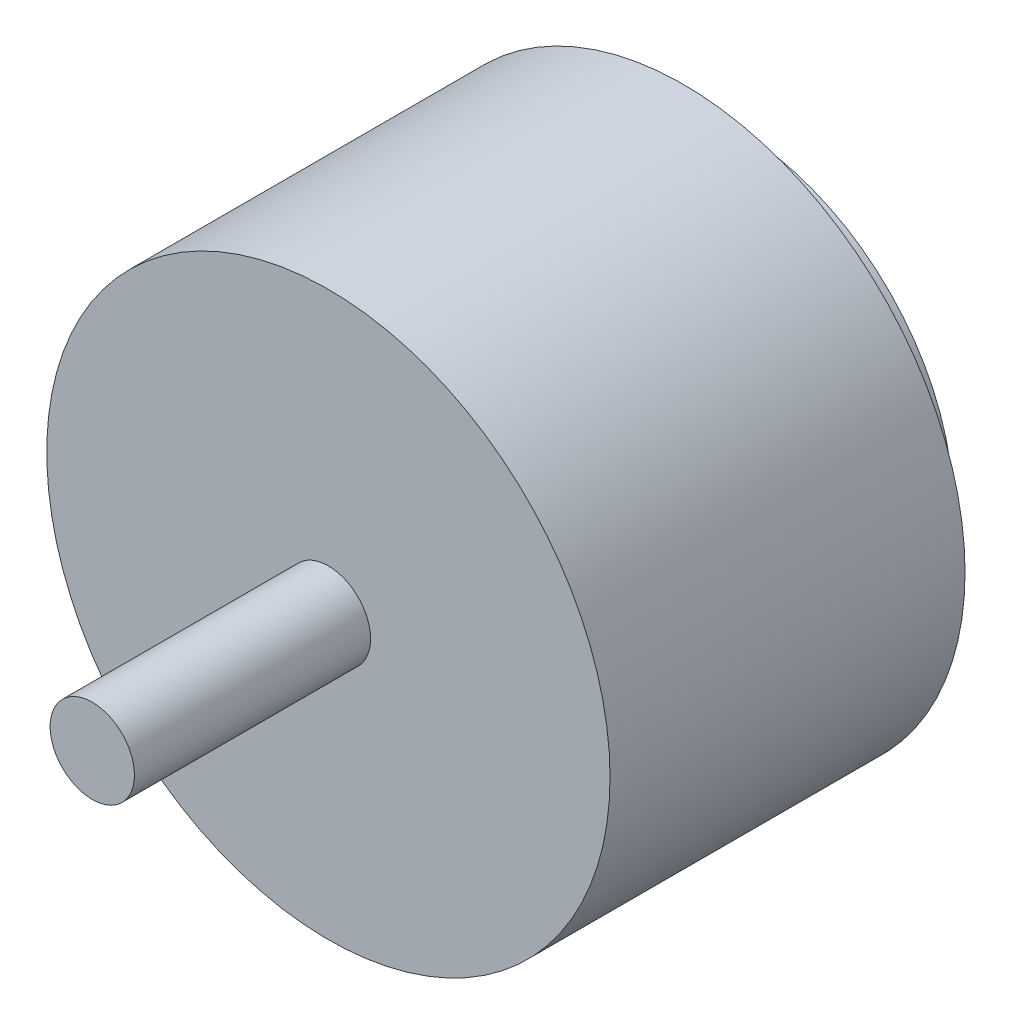
from build123d import *

# Parameters (mm, degrees)
SKETCH_1_R        = 13
SKETCH_1_R_2      = 1.6
EXTRUDE_228_DEPTH = 3
EXTRUDE_START     = 3
SKETCH_2_R        = 16.7
EXTRUDE_287_DEPTH = 21.05
M5_14MM_START     = 24.05
SKETCH_3_R        = 2.5
M5_14MM_DEPTH     = 14


with BuildPart() as part:
    # 草图1 → Extrude 228 (new body)
    with BuildSketch(Plane.XY):
        Circle(SKETCH_1_R)
        with Locations((-9.5, 0)):
            Circle(SKETCH_1_R_2, mode=Mode.SUBTRACT)
        with Locations((0, -9.5)):
            Circle(SKETCH_1_R_2, mode=Mode.SUBTRACT)
        with Locations((9.5, 0)):
            Circle(SKETCH_1_R_2, mode=Mode.SUBTRACT)
        with Locations((0, 9.5)):
            Circle(SKETCH_1_R_2, mode=Mode.SUBTRACT)
    extrude(amount=EXTRUDE_228_DEPTH)

    # 草图2 → Extrude 287 (add)
    with BuildSketch(Plane.XY.offset(EXTRUDE_START)):
        Circle(SKETCH_2_R)
    extrude(amount=EXTRUDE_287_DEPTH)

    # 草图3 → M5桨轴_外伸14mm (add)
    with BuildSketch(Plane.XY.offset(M5_14MM_START)):
        Circle(SKETCH_3_R)
    extrude(amount=M5_14MM_DEPTH)


solid = part.part
